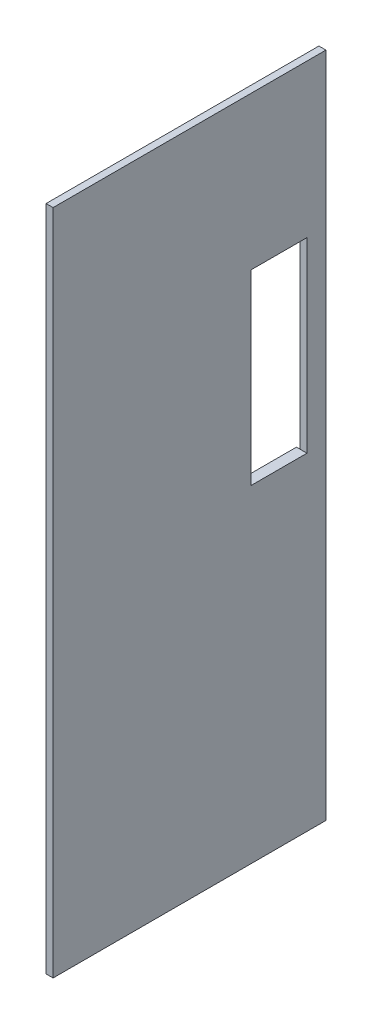
from build123d import *

# Parameters (mm, degrees)
SKETCH_1_W          = 95
SKETCH_1_H          = 38.85
EXTRUDE_1_DEPTH     = 1
SKETCH_2_W          = 33.45
SKETCH_2_H          = 89.6
EXTRUDE_2_DEPTH     = 0.5
SKETCH_3_W          = 7.954176302
SKETCH_3_H          = 26.586882205
CUT_EXTRUDE_1_DEPTH = 2


with BuildPart() as part:
    # Эскиз1 → Бобышка-Вытянуть1 (new body)
    with BuildSketch(Plane(origin=(0.5, 0, 0), x_dir=(0, -1, 0), z_dir=(-1, 0, 0))):
        with Locations((-53.35, 22.825)):
            Rectangle(SKETCH_1_W, SKETCH_1_H)
    extrude(amount=-EXTRUDE_1_DEPTH)

    # Эскиз2 → Бобышка-Вытянуть2 (add)
    with BuildSketch(Plane.ZY.offset(-0.5)):
        with Locations((22.825, 53.35)):
            Rectangle(SKETCH_2_W, SKETCH_2_H)
    extrude(amount=EXTRUDE_2_DEPTH)

    # Эскиз3 → Вырез-Вытянуть1 (cut)
    with BuildSketch(Plane.ZY):
        with Locations((10.077088151, 65.780778583)):
            Rectangle(SKETCH_3_W, SKETCH_3_H)
    extrude(amount=-CUT_EXTRUDE_1_DEPTH, mode=Mode.SUBTRACT)


solid = part.part
